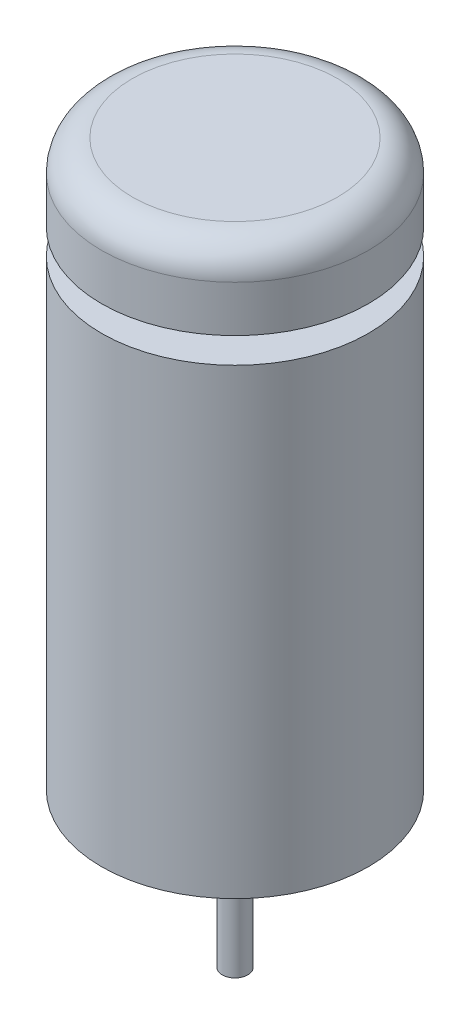
from build123d import *

# Parameters (mm, degrees)
SKETCH1_R           = 26
BOSS_EXTRUDE1_DEPTH = 90
SKETCH2_R           = 8.638646247
BOSS_EXTRUDE2_DEPTH = 5
SKETCH3_R           = 26
BOSS_EXTRUDE3_DEPTH = 15
SKETCH4_R           = 10.67473996
BOSS_EXTRUDE4_DEPTH = 5
SKETCH5_R           = 2.5
BOSS_EXTRUDE5_DEPTH = 25
FILLET1_R           = 6


with BuildPart() as part:
    # Sketch1 → Boss-Extrude1 (new body)
    with BuildSketch(Plane(origin=(0, 0, 0), x_dir=(1, 0, 0), z_dir=(0, 1, 0))):
        with Locations(Location((0, 0, 0), (0, 0, 90))):
            Circle(SKETCH1_R)
    extrude(amount=BOSS_EXTRUDE1_DEPTH)

    # Sketch2 → Boss-Extrude2 (add)
    with BuildSketch(Plane(origin=(0, 90, 0), x_dir=(1, 0, 0), z_dir=(0, 1, 0))):
        with Locations(Location((0, 0, 0), (0, 0, 270))):
            Circle(SKETCH2_R)
    extrude(amount=BOSS_EXTRUDE2_DEPTH)

    # Sketch3 → Boss-Extrude3 (add)
    with BuildSketch(Plane(origin=(0, 95, 0), x_dir=(1, 0, 0), z_dir=(0, 1, 0))):
        with Locations(Location((0, 0, 0), (0, 0, 90))):
            Circle(SKETCH3_R)
    extrude(amount=BOSS_EXTRUDE3_DEPTH)

    # Sketch4 → Boss-Extrude4 (add)
    with BuildSketch(Plane.XZ):
        with Locations(Location((0, 0, 0), (0, 0, 90))):
            Circle(SKETCH4_R)
    extrude(amount=BOSS_EXTRUDE4_DEPTH)

    # Sketch5 → Boss-Extrude5 (add)
    with BuildSketch(Plane.XZ.offset(5)):
        with Locations(Location((0, 0, 0), (0, 0, 270))):
            Circle(SKETCH5_R)
    extrude(amount=BOSS_EXTRUDE5_DEPTH)

    # Fillet1
    fillet1_edges = [part.edges().sort_by_distance(p)[0] for p in [
        (0, 110, 26),
    ]]
    fillet(fillet1_edges, radius=FILLET1_R)


solid = part.part
